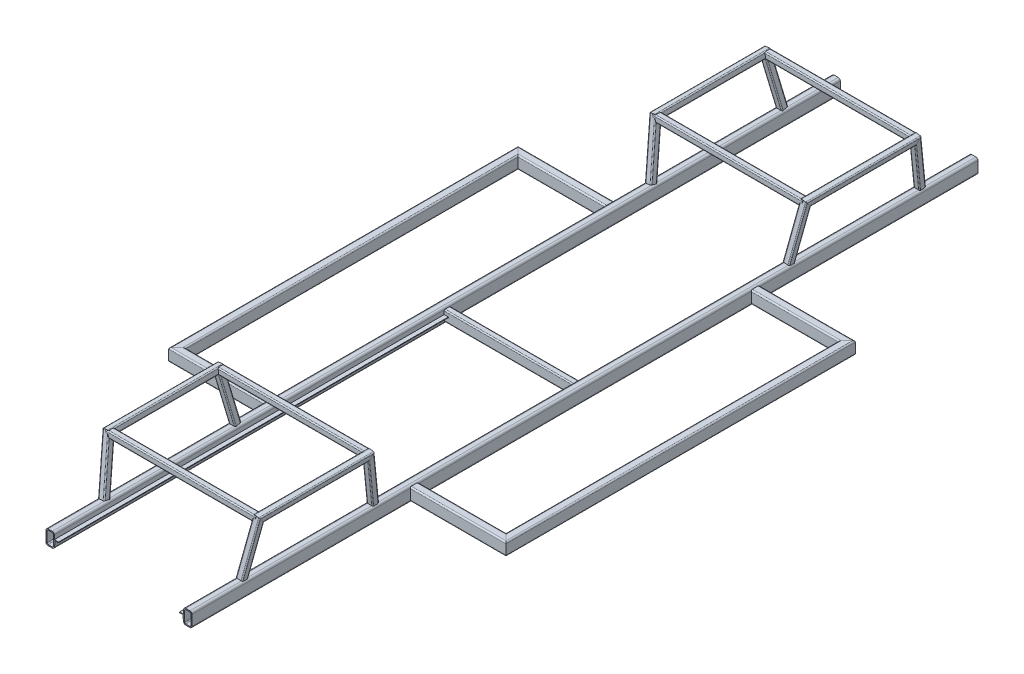
from build123d import *

# Parameters (mm, degrees)
RURA_PROSTOK_TNA_70_X_40_X_5_1_DEPTH          = 3780
RURA_PROSTOK_TNA_70_X_40_X_5_1_2_DEPTH        = 3780
RURA_PROSTOK_TNA_50_X_30_X_2_6_1_DEPTH        = 662
RURA_PROSTOK_TNA_60_X_40_X_3_2_1_DEPTH        = 497.055512755
RURA_PROSTOK_TNA_60_X_40_X_3_2_1_2_DEPTH      = 1714.111025509
RURA_PROSTOK_TNA_60_X_40_X_3_2_1_3_DEPTH      = 460
RURA_PROSTOK_TNA_60_X_40_X_3_2_1_3_DEPTH_BACK = 37.055512755
RURA_PROSTOK_TNA_60_X_40_X_3_2_1_4_DEPTH      = 497.055512755
RURA_PROSTOK_TNA_60_X_40_X_3_2_1_5_DEPTH      = 1714.111025509
RURA_PROSTOK_TNA_60_X_40_X_3_2_1_6_DEPTH      = 497.055512755
RURA_KWADRATOWA_30_X_30_X_2_6_2_DEPTH         = 265.394685788
RURA_KWADRATOWA_30_X_30_X_2_6_2_2_DEPTH       = 564.384290372
RURA_KWADRATOWA_30_X_30_X_2_6_2_3_DEPTH       = 265.394685788
RURA_KWADRATOWA_30_X_30_X_2_6_3_DEPTH         = 722
RURA_KWADRATOWA_30_X_30_X_2_6_3_2_DEPTH       = 722
DODANIE_WYCI_GNI_CIE1_DEPTH                   = 1875


with BuildPart() as part:
    # Sketch11 → Rura prostokątna 70 X 40 X 5(1) (new body)
    with BuildSketch(Plane(origin=(-331, 0, -3195), x_dir=(1, 0, 0), z_dir=(0, 0, 1))):
        with BuildLine():
            Line((-10, -35), (10, -35))
            ThreePointArc((10, -35), (17.071067812, -32.071067812), (20, -25))
            Line((20, -25), (20, 25))
            ThreePointArc((20, 25), (17.071067812, 32.071067812), (10, 35))
            Line((10, 35), (-10, 35))
            ThreePointArc((-10, 35), (-17.071067812, 32.071067812), (-20, 25))
            Line((-20, 25), (-20, -25))
            ThreePointArc((-20, -25), (-17.071067812, -32.071067812), (-10, -35))
        make_face()
        with BuildLine():
            Line((-10, -30), (10, -30))
            ThreePointArc((10, -30), (13.535533906, -28.535533906), (15, -25))
            Line((15, -25), (15, 25))
            ThreePointArc((15, 25), (13.535533906, 28.535533906), (10, 30))
            Line((10, 30), (-10, 30))
            ThreePointArc((-10, 30), (-13.535533906, 28.535533906), (-15, 25))
            Line((-15, 25), (-15, -25))
            ThreePointArc((-15, -25), (-13.535533906, -28.535533906), (-10, -30))
        make_face(mode=Mode.SUBTRACT)
    extrude(amount=RURA_PROSTOK_TNA_70_X_40_X_5_1_DEPTH)


with BuildPart() as body_2:
    # Sketch11 on segment 2 (carried to segment 2) → Rura prostok_tna 70 X 40 X 5_1 2 (new body)
    with BuildSketch(Plane(origin=(331, 0, -3195), x_dir=(1, 0, 0), z_dir=(0, 0, 1))):
        with BuildLine():
            Line((-10, -35), (10, -35))
            ThreePointArc((10, -35), (17.071067812, -32.071067812), (20, -25))
            Line((20, -25), (20, 25))
            ThreePointArc((20, 25), (17.071067812, 32.071067812), (10, 35))
            Line((10, 35), (-10, 35))
            ThreePointArc((-10, 35), (-17.071067812, 32.071067812), (-20, 25))
            Line((-20, 25), (-20, -25))
            ThreePointArc((-20, -25), (-17.071067812, -32.071067812), (-10, -35))
        make_face()
        with BuildLine():
            Line((-10, -30), (10, -30))
            ThreePointArc((10, -30), (13.535533906, -28.535533906), (15, -25))
            Line((15, -25), (15, 25))
            ThreePointArc((15, 25), (13.535533906, 28.535533906), (10, 30))
            Line((10, 30), (-10, 30))
            ThreePointArc((-10, 30), (-13.535533906, 28.535533906), (-15, 25))
            Line((-15, 25), (-15, -25))
            ThreePointArc((-15, -25), (-13.535533906, -28.535533906), (-10, -30))
        make_face(mode=Mode.SUBTRACT)
    extrude(amount=RURA_PROSTOK_TNA_70_X_40_X_5_1_2_DEPTH)


with BuildPart() as body_3:
    # Sketch1 → Rura prostokątna 50 X 30 X 2.6(1) (new body)
    with BuildSketch(Plane(origin=(-331, 0, -1305), x_dir=(0, 0, -1), z_dir=(1, 0, 0))):
        with BuildLine():
            Line((-9.8, -25), (9.8, -25))
            ThreePointArc((9.8, -25), (13.476955262, -23.476955262), (15, -19.8))
            Line((15, -19.8), (15, 19.8))
            ThreePointArc((15, 19.8), (13.476955262, 23.476955262), (9.8, 25))
            Line((9.8, 25), (-9.8, 25))
            ThreePointArc((-9.8, 25), (-13.476955262, 23.476955262), (-15, 19.8))
            Line((-15, 19.8), (-15, -19.8))
            ThreePointArc((-15, -19.8), (-13.476955262, -23.476955262), (-9.8, -25))
        make_face()
        with BuildLine():
            Line((-9.8, -22.4), (9.8, -22.4))
            ThreePointArc((9.8, -22.4), (11.638477631, -21.638477631), (12.4, -19.8))
            Line((12.4, -19.8), (12.4, 19.8))
            ThreePointArc((12.4, 19.8), (11.638477631, 21.638477631), (9.8, 22.4))
            Line((9.8, 22.4), (-9.8, 22.4))
            ThreePointArc((-9.8, 22.4), (-11.638477631, 21.638477631), (-12.4, 19.8))
            Line((-12.4, 19.8), (-12.4, -19.8))
            ThreePointArc((-12.4, -19.8), (-11.638477631, -21.638477631), (-9.8, -22.4))
        make_face(mode=Mode.SUBTRACT)
    extrude(amount=RURA_PROSTOK_TNA_50_X_30_X_2_6_1_DEPTH)


with BuildPart() as body_4:
    # Sketch12 on segment 1 (carried to segment 1) → Rura prostokątna 60 X 40 X 3.2(1) (new body)
    with BuildSketch(Plane(origin=(-331, 0, -2125), x_dir=(0, 0, 1), z_dir=(-1, 0, 0))):
        with BuildLine():
            Line((-13.6, -30), (13.6, -30))
            ThreePointArc((13.6, -30), (18.1254834, -28.1254834), (20, -23.6))
            Line((20, -23.6), (20, 23.6))
            ThreePointArc((20, 23.6), (18.1254834, 28.1254834), (13.6, 30))
            Line((13.6, 30), (-13.6, 30))
            ThreePointArc((-13.6, 30), (-18.1254834, 28.1254834), (-20, 23.6))
            Line((-20, 23.6), (-20, -23.6))
            ThreePointArc((-20, -23.6), (-18.1254834, -28.1254834), (-13.6, -30))
        make_face()
        with BuildLine():
            Line((-13.6, -26.8), (13.6, -26.8))
            ThreePointArc((13.6, -26.8), (15.8627417, -25.8627417), (16.8, -23.6))
            Line((16.8, -23.6), (16.8, 23.6))
            ThreePointArc((16.8, 23.6), (15.8627417, 25.8627417), (13.6, 26.8))
            Line((13.6, 26.8), (-13.6, 26.8))
            ThreePointArc((-13.6, 26.8), (-15.8627417, 25.8627417), (-16.8, 23.6))
            Line((-16.8, 23.6), (-16.8, -23.6))
            ThreePointArc((-16.8, -23.6), (-15.8627417, -25.8627417), (-13.6, -26.8))
        make_face(mode=Mode.SUBTRACT)
    extrude(amount=RURA_PROSTOK_TNA_60_X_40_X_3_2_1_DEPTH)

    # Rura prostokątna 60 X 40 X 3.2(1) mitre 1
    split(bisect_by=Plane(origin=(-791, 0, -2125), x_dir=(0, 1, 0), z_dir=(0.707106781, 0, -0.707106781)), keep=Keep.TOP)


with BuildPart() as body_5:
    # Sketch12 on segment 2 (carried to segment 2) → Rura prostok_tna 60 X 40 X 3.2_1 2 (new body)
    with BuildSketch(Plane(origin=(-791, 0, -2162.055512755), x_dir=(1, 0, 0), z_dir=(0, 0, 1))):
        with BuildLine():
            Line((-13.6, -30), (13.6, -30))
            ThreePointArc((13.6, -30), (18.1254834, -28.1254834), (20, -23.6))
            Line((20, -23.6), (20, 23.6))
            ThreePointArc((20, 23.6), (18.1254834, 28.1254834), (13.6, 30))
            Line((13.6, 30), (-13.6, 30))
            ThreePointArc((-13.6, 30), (-18.1254834, 28.1254834), (-20, 23.6))
            Line((-20, 23.6), (-20, -23.6))
            ThreePointArc((-20, -23.6), (-18.1254834, -28.1254834), (-13.6, -30))
        make_face()
        with BuildLine():
            Line((-13.6, -26.8), (13.6, -26.8))
            ThreePointArc((13.6, -26.8), (15.8627417, -25.8627417), (16.8, -23.6))
            Line((16.8, -23.6), (16.8, 23.6))
            ThreePointArc((16.8, 23.6), (15.8627417, 25.8627417), (13.6, 26.8))
            Line((13.6, 26.8), (-13.6, 26.8))
            ThreePointArc((-13.6, 26.8), (-15.8627417, 25.8627417), (-16.8, 23.6))
            Line((-16.8, 23.6), (-16.8, -23.6))
            ThreePointArc((-16.8, -23.6), (-15.8627417, -25.8627417), (-13.6, -26.8))
        make_face(mode=Mode.SUBTRACT)
    extrude(amount=RURA_PROSTOK_TNA_60_X_40_X_3_2_1_2_DEPTH)

    # Rura prostok_tna 60 X 40 X 3.2_1 2 mitre
    split(bisect_by=Plane(origin=(-791, 0, -2125), x_dir=(0, -1, 0), z_dir=(-0.707106781, 0, 0.707106781)), keep=Keep.TOP)

    # Rura prostok_tna 60 X 40 X 3.2_1 2 m 2
    split(bisect_by=Plane(origin=(-791, 0, -485), x_dir=(0, -1, 0), z_dir=(-0.707106781, 0, -0.707106781)), keep=Keep.TOP)


with BuildPart() as body_6:
    # Sketch12 → Rura prostok_tna 60 X 40 X 3.2_1 3 (new, two sides: drawn at the far end of the back side and taken through both)
    with BuildSketch(Plane(origin=(-791, 0, -485), x_dir=(0, 0, -1), z_dir=(1, 0, 0)).offset(-RURA_PROSTOK_TNA_60_X_40_X_3_2_1_3_DEPTH_BACK)):
        with BuildLine():
            Line((-13.6, -30), (13.6, -30))
            ThreePointArc((13.6, -30), (18.1254834, -28.1254834), (20, -23.6))
            Line((20, -23.6), (20, 23.6))
            ThreePointArc((20, 23.6), (18.1254834, 28.1254834), (13.6, 30))
            Line((13.6, 30), (-13.6, 30))
            ThreePointArc((-13.6, 30), (-18.1254834, 28.1254834), (-20, 23.6))
            Line((-20, 23.6), (-20, -23.6))
            ThreePointArc((-20, -23.6), (-18.1254834, -28.1254834), (-13.6, -30))
        make_face()
        with BuildLine():
            Line((-13.6, -26.8), (13.6, -26.8))
            ThreePointArc((13.6, -26.8), (15.8627417, -25.8627417), (16.8, -23.6))
            Line((16.8, -23.6), (16.8, 23.6))
            ThreePointArc((16.8, 23.6), (15.8627417, 25.8627417), (13.6, 26.8))
            Line((13.6, 26.8), (-13.6, 26.8))
            ThreePointArc((-13.6, 26.8), (-15.8627417, 25.8627417), (-16.8, 23.6))
            Line((-16.8, 23.6), (-16.8, -23.6))
            ThreePointArc((-16.8, -23.6), (-15.8627417, -25.8627417), (-13.6, -26.8))
        make_face(mode=Mode.SUBTRACT)
    extrude(amount=RURA_PROSTOK_TNA_60_X_40_X_3_2_1_3_DEPTH + RURA_PROSTOK_TNA_60_X_40_X_3_2_1_3_DEPTH_BACK)

    # Rura prostok_tna 60 X 40 X 3.2_1 3 mitre
    split(bisect_by=Plane(origin=(-791, 0, -485), x_dir=(0, 1, 0), z_dir=(0.707106781, 0, 0.707106781)), keep=Keep.TOP)


with BuildPart() as body_7:
    # Sketch12 on segment 4 (carried to segment 4) → Rura prostok_tna 60 X 40 X 3.2_1 4 (new body)
    with BuildSketch(Plane(origin=(331, 0, -2125), x_dir=(0, 0, -1), z_dir=(1, 0, 0))):
        with BuildLine():
            Line((-13.6, -30), (13.6, -30))
            ThreePointArc((13.6, -30), (18.1254834, -28.1254834), (20, -23.6))
            Line((20, -23.6), (20, 23.6))
            ThreePointArc((20, 23.6), (18.1254834, 28.1254834), (13.6, 30))
            Line((13.6, 30), (-13.6, 30))
            ThreePointArc((-13.6, 30), (-18.1254834, 28.1254834), (-20, 23.6))
            Line((-20, 23.6), (-20, -23.6))
            ThreePointArc((-20, -23.6), (-18.1254834, -28.1254834), (-13.6, -30))
        make_face()
        with BuildLine():
            Line((-13.6, -26.8), (13.6, -26.8))
            ThreePointArc((13.6, -26.8), (15.8627417, -25.8627417), (16.8, -23.6))
            Line((16.8, -23.6), (16.8, 23.6))
            ThreePointArc((16.8, 23.6), (15.8627417, 25.8627417), (13.6, 26.8))
            Line((13.6, 26.8), (-13.6, 26.8))
            ThreePointArc((-13.6, 26.8), (-15.8627417, 25.8627417), (-16.8, 23.6))
            Line((-16.8, 23.6), (-16.8, -23.6))
            ThreePointArc((-16.8, -23.6), (-15.8627417, -25.8627417), (-13.6, -26.8))
        make_face(mode=Mode.SUBTRACT)
    extrude(amount=RURA_PROSTOK_TNA_60_X_40_X_3_2_1_4_DEPTH)

    # Rura prostok_tna 60 X 40 X 3.2_1 4 mitre
    split(bisect_by=Plane(origin=(791, 0, -2125), x_dir=(0, -1, 0), z_dir=(-0.707106781, 0, -0.707106781)), keep=Keep.TOP)


with BuildPart() as body_8:
    # Sketch12 on segment 5 (carried to segment 5) → Rura prostok_tna 60 X 40 X 3.2_1 5 (new body)
    with BuildSketch(Plane(origin=(791, 0, -2162.055512755), x_dir=(1, 0, 0), z_dir=(0, 0, 1))):
        with BuildLine():
            Line((-13.6, -30), (13.6, -30))
            ThreePointArc((13.6, -30), (18.1254834, -28.1254834), (20, -23.6))
            Line((20, -23.6), (20, 23.6))
            ThreePointArc((20, 23.6), (18.1254834, 28.1254834), (13.6, 30))
            Line((13.6, 30), (-13.6, 30))
            ThreePointArc((-13.6, 30), (-18.1254834, 28.1254834), (-20, 23.6))
            Line((-20, 23.6), (-20, -23.6))
            ThreePointArc((-20, -23.6), (-18.1254834, -28.1254834), (-13.6, -30))
        make_face()
        with BuildLine():
            Line((-13.6, -26.8), (13.6, -26.8))
            ThreePointArc((13.6, -26.8), (15.8627417, -25.8627417), (16.8, -23.6))
            Line((16.8, -23.6), (16.8, 23.6))
            ThreePointArc((16.8, 23.6), (15.8627417, 25.8627417), (13.6, 26.8))
            Line((13.6, 26.8), (-13.6, 26.8))
            ThreePointArc((-13.6, 26.8), (-15.8627417, 25.8627417), (-16.8, 23.6))
            Line((-16.8, 23.6), (-16.8, -23.6))
            ThreePointArc((-16.8, -23.6), (-15.8627417, -25.8627417), (-13.6, -26.8))
        make_face(mode=Mode.SUBTRACT)
    extrude(amount=RURA_PROSTOK_TNA_60_X_40_X_3_2_1_5_DEPTH)

    # Rura prostok_tna 60 X 40 X 3.2_1 5 mitre
    split(bisect_by=Plane(origin=(791, 0, -2125), x_dir=(0, 1, 0), z_dir=(0.707106781, 0, 0.707106781)), keep=Keep.TOP)

    # Rura prostok_tna 60 X 40 X 3.2_1 5 m 2
    split(bisect_by=Plane(origin=(791, 0, -485), x_dir=(0, 1, 0), z_dir=(0.707106781, 0, -0.707106781)), keep=Keep.TOP)


with BuildPart() as body_9:
    # Sketch12 on segment 6 (carried to segment 6) → Rura prostok_tna 60 X 40 X 3.2_1 6 (new body)
    with BuildSketch(Plane(origin=(828.055512755, 0, -485), x_dir=(0, 0, 1), z_dir=(-1, 0, 0))):
        with BuildLine():
            Line((-13.6, -30), (13.6, -30))
            ThreePointArc((13.6, -30), (18.1254834, -28.1254834), (20, -23.6))
            Line((20, -23.6), (20, 23.6))
            ThreePointArc((20, 23.6), (18.1254834, 28.1254834), (13.6, 30))
            Line((13.6, 30), (-13.6, 30))
            ThreePointArc((-13.6, 30), (-18.1254834, 28.1254834), (-20, 23.6))
            Line((-20, 23.6), (-20, -23.6))
            ThreePointArc((-20, -23.6), (-18.1254834, -28.1254834), (-13.6, -30))
        make_face()
        with BuildLine():
            Line((-13.6, -26.8), (13.6, -26.8))
            ThreePointArc((13.6, -26.8), (15.8627417, -25.8627417), (16.8, -23.6))
            Line((16.8, -23.6), (16.8, 23.6))
            ThreePointArc((16.8, 23.6), (15.8627417, 25.8627417), (13.6, 26.8))
            Line((13.6, 26.8), (-13.6, 26.8))
            ThreePointArc((-13.6, 26.8), (-15.8627417, 25.8627417), (-16.8, 23.6))
            Line((-16.8, 23.6), (-16.8, -23.6))
            ThreePointArc((-16.8, -23.6), (-15.8627417, -25.8627417), (-13.6, -26.8))
        make_face(mode=Mode.SUBTRACT)
    extrude(amount=RURA_PROSTOK_TNA_60_X_40_X_3_2_1_6_DEPTH)

    # Rura prostok_tna 60 X 40 X 3.2_1 6 mitre
    split(bisect_by=Plane(origin=(791, 0, -485), x_dir=(0, -1, 0), z_dir=(-0.707106781, 0, 0.707106781)), keep=Keep.TOP)


with BuildPart() as body_10:
    # Sketch14 → Rura kwadratowa 30 X 30 X 2.6(2) (new body)
    with BuildSketch(Plane(origin=(-331, 35, -2935), x_dir=(-0.02559764425710186, 0.20478115405681155, -0.9784730142173811), z_dir=(-0.12136464062115564, 0.9709171249692453, 0.20637480575000608))):
        with BuildLine():
            Line((-9.8, -15), (9.8, -15))
            ThreePointArc((9.8, -15), (13.476955262, -13.476955262), (15, -9.8))
            Line((15, -9.8), (15, 9.8))
            ThreePointArc((15, 9.8), (13.476955262, 13.476955262), (9.8, 15))
            Line((9.8, 15), (-9.8, 15))
            ThreePointArc((-9.8, 15), (-13.476955262, 13.476955262), (-15, 9.8))
            Line((-15, 9.8), (-15, -9.8))
            ThreePointArc((-15, -9.8), (-13.476955262, -13.476955262), (-9.8, -15))
        make_face()
        with BuildLine():
            Line((-9.8, -12.4), (9.8, -12.4))
            ThreePointArc((9.8, -12.4), (11.638477631, -11.638477631), (12.4, -9.8))
            Line((12.4, -9.8), (12.4, 9.8))
            ThreePointArc((12.4, 9.8), (11.638477631, 11.638477631), (9.8, 12.4))
            Line((9.8, 12.4), (-9.8, 12.4))
            ThreePointArc((-9.8, 12.4), (-11.638477631, 11.638477631), (-12.4, 9.8))
            Line((-12.4, 9.8), (-12.4, -9.8))
            ThreePointArc((-12.4, -9.8), (-11.638477631, -11.638477631), (-9.8, -12.4))
        make_face(mode=Mode.SUBTRACT)
    extrude(amount=RURA_KWADRATOWA_30_X_30_X_2_6_2_DEPTH)

    # Rura kwadratowa 30 X 30 X 2.6(2) mitre 1
    split(bisect_by=Plane(origin=(-361, 275, -2883.986425199), x_dir=(0.992277877, 0.124034735, 0), z_dir=(0.078133278, -0.625066227, -0.776651404)), keep=Keep.TOP)


with BuildPart() as body_11:
    # Sketch14 on segment 2 (carried to segment 2) → Rura kwadratowa 30 X 30 X 2.6_2 2 (new body)
    with BuildSketch(Plane(origin=(-361, 275, -2902.192145186), x_dir=(-0.124034735, 0.992277877, 0), z_dir=(0, 0, 1))):
        with BuildLine():
            Line((-9.8, -15), (9.8, -15))
            ThreePointArc((9.8, -15), (13.476955262, -13.476955262), (15, -9.8))
            Line((15, -9.8), (15, 9.8))
            ThreePointArc((15, 9.8), (13.476955262, 13.476955262), (9.8, 15))
            Line((9.8, 15), (-9.8, 15))
            ThreePointArc((-9.8, 15), (-13.476955262, 13.476955262), (-15, 9.8))
            Line((-15, 9.8), (-15, -9.8))
            ThreePointArc((-15, -9.8), (-13.476955262, -13.476955262), (-9.8, -15))
        make_face()
        with BuildLine():
            Line((-9.8, -12.4), (9.8, -12.4))
            ThreePointArc((9.8, -12.4), (11.638477631, -11.638477631), (12.4, -9.8))
            Line((12.4, -9.8), (12.4, 9.8))
            ThreePointArc((12.4, 9.8), (11.638477631, 11.638477631), (9.8, 12.4))
            Line((9.8, 12.4), (-9.8, 12.4))
            ThreePointArc((-9.8, 12.4), (-11.638477631, 11.638477631), (-12.4, 9.8))
            Line((-12.4, 9.8), (-12.4, -9.8))
            ThreePointArc((-12.4, -9.8), (-11.638477631, -11.638477631), (-9.8, -12.4))
        make_face(mode=Mode.SUBTRACT)
    extrude(amount=RURA_KWADRATOWA_30_X_30_X_2_6_2_2_DEPTH)

    # Rura kwadratowa 30 X 30 X 2.6_2 2 mitre
    split(bisect_by=Plane(origin=(-361, 275, -2883.986425199), x_dir=(-0.992277877, -0.124034735, 0), z_dir=(-0.078133278, 0.625066227, 0.776651404)), keep=Keep.TOP)

    # Rura kwadratowa 30 X 30 X 2.6_2 2 mi 2
    split(bisect_by=Plane(origin=(-361, 275, -2356.013574801), x_dir=(-0.992277877, -0.124034735, 0), z_dir=(-0.078133278, 0.625066227, -0.776651404)), keep=Keep.TOP)


with BuildPart() as body_12:
    # Sketch14 on segment 3 (carried to segment 3) → Rura kwadratowa 30 X 30 X 2.6_2 3 (new body)
    with BuildSketch(Plane(origin=(-363.209530663, 292.676245308, -2359.770776727), x_dir=(-0.025597644, 0.204781154, 0.978473014), z_dir=(0.121364641, -0.970917125, 0.206374806))):
        with BuildLine():
            Line((-9.8, -15), (9.8, -15))
            ThreePointArc((9.8, -15), (13.476955262, -13.476955262), (15, -9.8))
            Line((15, -9.8), (15, 9.8))
            ThreePointArc((15, 9.8), (13.476955262, 13.476955262), (9.8, 15))
            Line((9.8, 15), (-9.8, 15))
            ThreePointArc((-9.8, 15), (-13.476955262, 13.476955262), (-15, 9.8))
            Line((-15, 9.8), (-15, -9.8))
            ThreePointArc((-15, -9.8), (-13.476955262, -13.476955262), (-9.8, -15))
        make_face()
        with BuildLine():
            Line((-9.8, -12.4), (9.8, -12.4))
            ThreePointArc((9.8, -12.4), (11.638477631, -11.638477631), (12.4, -9.8))
            Line((12.4, -9.8), (12.4, 9.8))
            ThreePointArc((12.4, 9.8), (11.638477631, 11.638477631), (9.8, 12.4))
            Line((9.8, 12.4), (-9.8, 12.4))
            ThreePointArc((-9.8, 12.4), (-11.638477631, 11.638477631), (-12.4, 9.8))
            Line((-12.4, 9.8), (-12.4, -9.8))
            ThreePointArc((-12.4, -9.8), (-11.638477631, -11.638477631), (-9.8, -12.4))
        make_face(mode=Mode.SUBTRACT)
    extrude(amount=RURA_KWADRATOWA_30_X_30_X_2_6_2_3_DEPTH)

    # Rura kwadratowa 30 X 30 X 2.6_2 3 mitre
    split(bisect_by=Plane(origin=(-361, 275, -2356.013574801), x_dir=(0.992277877, 0.124034735, 0), z_dir=(0.078133278, -0.625066227, 0.776651404)), keep=Keep.TOP)


with BuildPart() as body_13:
    # Lustro1: mirrored copy
    add(body_10.part.mirror(Plane(origin=(0, 0, 0), x_dir=(0, 0, 1), z_dir=(1, 0, 0))))


with BuildPart() as body_14:
    # Lustro1 2: mirrored copy
    add(body_11.part.mirror(Plane(origin=(0, 0, 0), x_dir=(0, 0, 1), z_dir=(1, 0, 0))))


with BuildPart() as body_15:
    # Lustro1 3: mirrored copy
    add(body_12.part.mirror(Plane(origin=(0, 0, 0), x_dir=(0, 0, 1), z_dir=(1, 0, 0))))


with BuildPart() as body_16:
    # Sketch15 → Rura kwadratowa 30 X 30 X 2.6(3) (new body)
    with BuildSketch(Plane(origin=(361, 275, -2356.013574801), x_dir=(0, 0, 1), z_dir=(-1, 0, 0))):
        with BuildLine():
            Line((-9.8, -15), (9.8, -15))
            ThreePointArc((9.8, -15), (13.476955262, -13.476955262), (15, -9.8))
            Line((15, -9.8), (15, 9.8))
            ThreePointArc((15, 9.8), (13.476955262, 13.476955262), (9.8, 15))
            Line((9.8, 15), (-9.8, 15))
            ThreePointArc((-9.8, 15), (-13.476955262, 13.476955262), (-15, 9.8))
            Line((-15, 9.8), (-15, -9.8))
            ThreePointArc((-15, -9.8), (-13.476955262, -13.476955262), (-9.8, -15))
        make_face()
        with BuildLine():
            Line((-9.8, -12.4), (9.8, -12.4))
            ThreePointArc((9.8, -12.4), (11.638477631, -11.638477631), (12.4, -9.8))
            Line((12.4, -9.8), (12.4, 9.8))
            ThreePointArc((12.4, 9.8), (11.638477631, 11.638477631), (9.8, 12.4))
            Line((9.8, 12.4), (-9.8, 12.4))
            ThreePointArc((-9.8, 12.4), (-11.638477631, 11.638477631), (-12.4, 9.8))
            Line((-12.4, 9.8), (-12.4, -9.8))
            ThreePointArc((-12.4, -9.8), (-11.638477631, -11.638477631), (-9.8, -12.4))
        make_face(mode=Mode.SUBTRACT)
    extrude(amount=RURA_KWADRATOWA_30_X_30_X_2_6_3_DEPTH)


with BuildPart() as body_17:
    # Sketch15 on segment 2 (carried to segment 2) → Rura kwadratowa 30 X 30 X 2.6_3 2 (new body)
    with BuildSketch(Plane(origin=(361, 275, -2883.986425199), x_dir=(0, 0, 1), z_dir=(-1, 0, 0))):
        with BuildLine():
            Line((-9.8, -15), (9.8, -15))
            ThreePointArc((9.8, -15), (13.476955262, -13.476955262), (15, -9.8))
            Line((15, -9.8), (15, 9.8))
            ThreePointArc((15, 9.8), (13.476955262, 13.476955262), (9.8, 15))
            Line((9.8, 15), (-9.8, 15))
            ThreePointArc((-9.8, 15), (-13.476955262, 13.476955262), (-15, 9.8))
            Line((-15, 9.8), (-15, -9.8))
            ThreePointArc((-15, -9.8), (-13.476955262, -13.476955262), (-9.8, -15))
        make_face()
        with BuildLine():
            Line((-9.8, -12.4), (9.8, -12.4))
            ThreePointArc((9.8, -12.4), (11.638477631, -11.638477631), (12.4, -9.8))
            Line((12.4, -9.8), (12.4, 9.8))
            ThreePointArc((12.4, 9.8), (11.638477631, 11.638477631), (9.8, 12.4))
            Line((9.8, 12.4), (-9.8, 12.4))
            ThreePointArc((-9.8, 12.4), (-11.638477631, 11.638477631), (-12.4, 9.8))
            Line((-12.4, 9.8), (-12.4, -9.8))
            ThreePointArc((-12.4, -9.8), (-11.638477631, -11.638477631), (-9.8, -12.4))
        make_face(mode=Mode.SUBTRACT)
    extrude(amount=RURA_KWADRATOWA_30_X_30_X_2_6_3_2_DEPTH)


with BuildPart() as body_18:
    # Lustro2: mirrored copy
    add(body_10.part.mirror(Plane(origin=(0, 0, -1305), x_dir=(1, 0, 0), z_dir=(0, 0, -1))))


with BuildPart() as body_19:
    # Lustro2 2: mirrored copy
    add(body_11.part.mirror(Plane(origin=(0, 0, -1305), x_dir=(1, 0, 0), z_dir=(0, 0, -1))))


with BuildPart() as body_20:
    # Lustro2 3: mirrored copy
    add(body_12.part.mirror(Plane(origin=(0, 0, -1305), x_dir=(1, 0, 0), z_dir=(0, 0, -1))))


with BuildPart() as body_21:
    # Lustro2 4: mirrored copy
    add(body_15.part.mirror(Plane(origin=(0, 0, -1305), x_dir=(1, 0, 0), z_dir=(0, 0, -1))))


with BuildPart() as body_22:
    # Lustro2 5: mirrored copy
    add(body_14.part.mirror(Plane(origin=(0, 0, -1305), x_dir=(1, 0, 0), z_dir=(0, 0, -1))))


with BuildPart() as body_23:
    # Lustro2 6: mirrored copy
    add(body_13.part.mirror(Plane(origin=(0, 0, -1305), x_dir=(1, 0, 0), z_dir=(0, 0, -1))))


with BuildPart() as body_24:
    # Lustro2 7: mirrored copy
    add(body_17.part.mirror(Plane(origin=(0, 0, -1305), x_dir=(1, 0, 0), z_dir=(0, 0, -1))))


with BuildPart() as body_25:
    # Lustro2 8: mirrored copy
    add(body_16.part.mirror(Plane(origin=(0, 0, -1305), x_dir=(1, 0, 0), z_dir=(0, 0, -1))))


with BuildPart() as body_26:
    # Szkic19 → Dodanie-wyciągnięcie1 (new body)
    with BuildSketch(Plane(origin=(0, 0, 585), x_dir=(-1, 0, 0), z_dir=(0, 0, -1))):
        with BuildLine():
            Line((-311, 5), (-311, -15))
            Line((-311, -15), (-308, -15))
            Line((-308, -15), (-308, -1.5))
            ThreePointArc((-308, -1.5), (-306.974873734, 0.974873734), (-304.5, 2))
            Line((-304.5, 2), (-291, 2))
            Line((-291, 2), (-291, 5))
            Line((-291, 5), (-311, 5))
        make_face()
    extrude(amount=DODANIE_WYCI_GNI_CIE1_DEPTH)


with BuildPart() as body_27:
    # Lustro3: mirrored copy
    add(body_26.part.mirror(Plane(origin=(0, 0, 0), x_dir=(0, 0, 1), z_dir=(1, 0, 0))))


solid = Compound([part.part, body_2.part, body_3.part, body_4.part, body_5.part, body_6.part, body_7.part, body_8.part, body_9.part, body_10.part, body_11.part, body_12.part, body_13.part, body_14.part, body_15.part, body_16.part, body_17.part, body_18.part, body_19.part, body_20.part, body_21.part, body_22.part, body_23.part, body_24.part, body_25.part, body_26.part, body_27.part])
